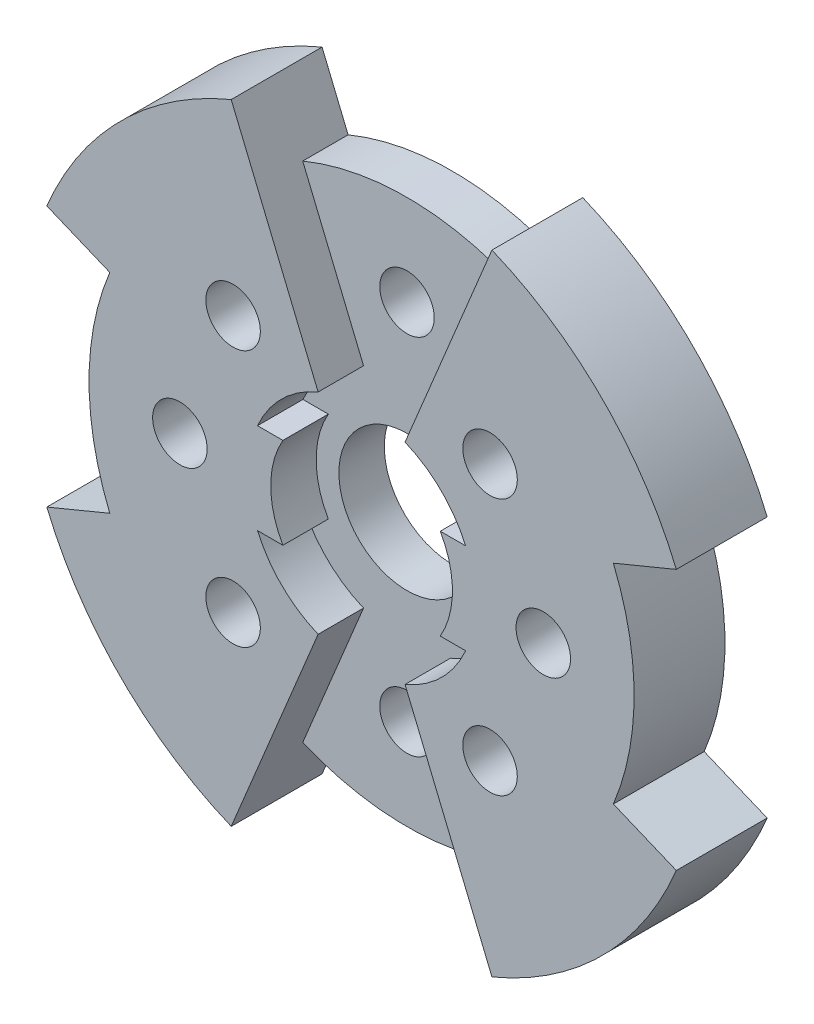
from build123d import *

# Parameters (mm, degrees)
SKETCH1_R             = 6
BOSS_EXTRUDE1_DEPTH   = 20
BOSS_EXTRUDE1_2_DEPTH = 20
SKETCH1_3_R           = 6
SKETCH1_3_R_2         = 15
BOSS_EXTRUDE2_DEPTH   = 10


with BuildPart() as part:
    # Sketch1 → Boss-Extrude1 (new body)
    with BuildSketch(Plane.XY):
        with BuildLine():
            Line((22.912878475, 10), (17.320508076, 10))
            ThreePointArc((17.320508076, 10), (20, 0), (17.320508076, -10))
            Line((17.320508076, -10), (22.912878475, -10))
            ThreePointArc((22.912878475, -10), (17.510562404, -17.843211715), (9.567085809, -23.096988313))
            Line((9.567085809, -23.096988313), (28.701257427, -69.290964938))
            ThreePointArc((28.701257427, -69.290964938), (53.033008589, -53.033008589), (69.290964938, -28.701257427))
            Line((69.290964938, -28.701257427), (55.432771951, -22.961005942))
            ThreePointArc((55.432771951, -22.961005942), (60, 0), (55.432771951, 22.961005942))
            Line((55.432771951, 22.961005942), (69.290964938, 28.701257427))
            ThreePointArc((69.290964938, 28.701257427), (53.033008589, 53.033008589), (28.701257427, 69.290964938))
            Line((28.701257427, 69.290964938), (9.567085809, 23.096988313))
            ThreePointArc((9.567085809, 23.096988313), (17.510562404, 17.843211715), (22.912878475, 10))
        make_face()
        with Locations((28.284271247, -28.284271247)):
            Circle(SKETCH1_R, mode=Mode.SUBTRACT)
        with Locations((28.284271247, 28.284271247)):
            Circle(SKETCH1_R, mode=Mode.SUBTRACT)
        with Locations((40, 0)):
            Circle(SKETCH1_R, mode=Mode.SUBTRACT)
    extrude(amount=BOSS_EXTRUDE1_DEPTH)



with BuildPart() as body_2:
    # Sketch1 → Boss-Extrude1 2 (new body)
    with BuildSketch(Plane.XY):
        with BuildLine():
            Line((-9.567085809, 23.096988313), (-28.701257427, 69.290964938))
            ThreePointArc((-28.701257427, 69.290964938), (-53.033008589, 53.033008589), (-69.290964938, 28.701257427))
            Line((-69.290964938, 28.701257427), (-55.432771951, 22.961005942))
            ThreePointArc((-55.432771951, 22.961005942), (-60, 0), (-55.432771951, -22.961005942))
            Line((-55.432771951, -22.961005942), (-69.290964938, -28.701257427))
            ThreePointArc((-69.290964938, -28.701257427), (-53.033008589, -53.033008589), (-28.701257427, -69.290964938))
            Line((-28.701257427, -69.290964938), (-9.567085809, -23.096988313))
            ThreePointArc((-9.567085809, -23.096988313), (-17.510562404, -17.843211715), (-22.912878475, -10))
            Line((-22.912878475, -10), (-17.320508076, -10))
            ThreePointArc((-17.320508076, -10), (-20, 0), (-17.320508076, 10))
            Line((-17.320508076, 10), (-22.912878475, 10))
            ThreePointArc((-22.912878475, 10), (-17.510562404, 17.843211715), (-9.567085809, 23.096988313))
        make_face()
        with Locations((-28.284271247, -28.284271247)):
            Circle(SKETCH1_R, mode=Mode.SUBTRACT)
        with Locations((-40, 0)):
            Circle(SKETCH1_R, mode=Mode.SUBTRACT)
        with Locations((-28.284271247, 28.284271247)):
            Circle(SKETCH1_R, mode=Mode.SUBTRACT)
    extrude(amount=BOSS_EXTRUDE1_2_DEPTH)


with BuildPart() as part_1:
    add(part.part)

    add(body_2.part)  # Boss-Extrude2 merges body 2
    # Sketch1<3> → Boss-Extrude2 (add)
    with BuildSketch(Plane.XY):
        with BuildLine():
            ThreePointArc((17.320508076, -10), (20, 0), (17.320508076, 10))
            Line((17.320508076, 10), (22.912878475, 10))
            ThreePointArc((22.912878475, 10), (17.510562404, 17.843211715), (9.567085809, 23.096988313))
            Line((9.567085809, 23.096988313), (22.961005942, 55.432771951))
            ThreePointArc((22.961005942, 55.432771951), (0, 60), (-22.961005942, 55.432771951))
            Line((-22.961005942, 55.432771951), (-9.567085809, 23.096988313))
            ThreePointArc((-9.567085809, 23.096988313), (-17.510562404, 17.843211715), (-22.912878475, 10))
            Line((-22.912878475, 10), (-17.320508076, 10))
            ThreePointArc((-17.320508076, 10), (-20, 0), (-17.320508076, -10))
            Line((-17.320508076, -10), (-22.912878475, -10))
            ThreePointArc((-22.912878475, -10), (-17.510562404, -17.843211715), (-9.567085809, -23.096988313))
            Line((-9.567085809, -23.096988313), (-22.961005942, -55.432771951))
            ThreePointArc((-22.961005942, -55.432771951), (0, -60), (22.961005942, -55.432771951))
            Line((22.961005942, -55.432771951), (9.567085809, -23.096988313))
            ThreePointArc((9.567085809, -23.096988313), (17.510562404, -17.843211715), (22.912878475, -10))
            Line((22.912878475, -10), (17.320508076, -10))
        make_face()
        with Locations((0, -40)):
            Circle(SKETCH1_3_R, mode=Mode.SUBTRACT)
        Circle(SKETCH1_3_R_2, mode=Mode.SUBTRACT)
        with Locations((0, 40)):
            Circle(SKETCH1_3_R, mode=Mode.SUBTRACT)
    extrude(amount=BOSS_EXTRUDE2_DEPTH)


solid = part_1.part
